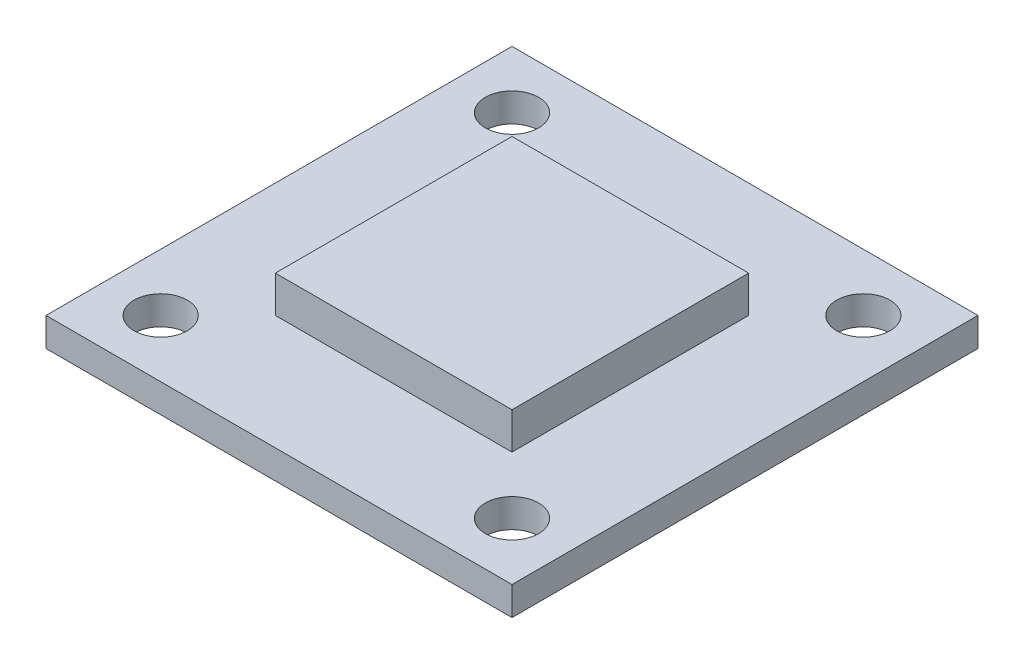
from build123d import *

# Parameters (mm, degrees)
SKETCH1_W                   = 25.8064
SKETCH1_H                   = 25.8064
BOSS_EXTRUDE1_DEPTH         = 1.5875
SKETCH2_W                   = 13.1064
SKETCH2_H                   = 13.1064
BOSS_EXTRUDE2_DEPTH         = 2.032
F_32_0_116_DIAMETER_HOLE1_D = 2.9464


with BuildPart() as part:
    # Sketch1 → Boss-Extrude1 (new body)
    with BuildSketch(Plane(origin=(0, 0, 0), x_dir=(1, 0, 0), z_dir=(0, 1, 0))):
        Rectangle(SKETCH1_W, SKETCH1_H)
    extrude(amount=BOSS_EXTRUDE1_DEPTH)

    # Sketch2 → Boss-Extrude2 (add)
    with BuildSketch(Plane(origin=(0, 1.5875, 0), x_dir=(1, 0, 0), z_dir=(0, 1, 0))):
        Rectangle(SKETCH2_W, SKETCH2_H)
    extrude(amount=BOSS_EXTRUDE2_DEPTH)

    # #32 (0.116) Diameter Hole1 (through all)
    with Locations(Plane(origin=(-9.7282, 1.5875, -9.7282), x_dir=(0, 0, 1), z_dir=(0, 1, 0))):
        with Locations((0, 0), (19.4564, 0), (19.4564, 19.4564), (0, 19.4564)):
            Hole(F_32_0_116_DIAMETER_HOLE1_D / 2)


solid = part.part
